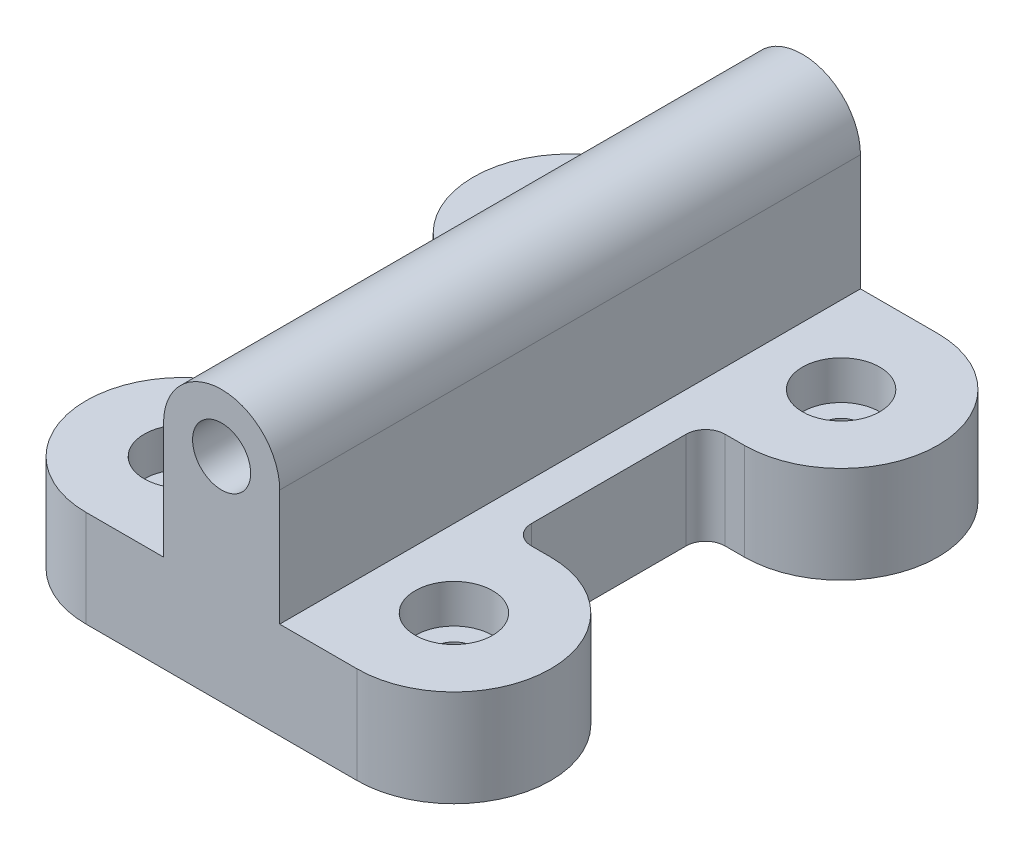
from build123d import *

# Parameters (mm, degrees)
SKETCH_1_R          = 1
EXTRUDE_1_DEPTH     = 5
SKETCH_7_R          = 1.5
EXTRUDE_3_DEPTH     = 30
SKETCH_8_R          = 2
CUT_EXTRUDE_1_DEPTH = 2


with BuildPart() as part:
    # 草图1 → 凸台-拉伸1 (new body)
    with BuildSketch(Plane(origin=(0, 0, 0), x_dir=(1, 0, 0), z_dir=(0, 1, 0))):
        with BuildLine():
            Line((-21.819389518, 18.45581381), (-20.819389518, 18.45581381))
            ThreePointArc((-20.819389518, 18.45581381), (-20.112282737, 18.748707029), (-19.819389518, 19.45581381))
            Line((-19.819389518, 19.45581381), (-19.819389518, 27.45581381))
            ThreePointArc((-19.819389518, 27.45581381), (-20.112282737, 28.162920591), (-20.819389518, 28.45581381))
            Line((-20.819389518, 28.45581381), (-21.819389518, 28.45581381))
            ThreePointArc((-21.819389518, 28.45581381), (-26.819389518, 33.45581381), (-21.819389518, 38.45581381))
            Line((-21.819389518, 38.45581381), (-7.819389518, 38.45581381))
            ThreePointArc((-7.819389518, 38.45581381), (-2.819389518, 33.45581381), (-7.819389518, 28.45581381))
            Line((-7.819389518, 28.45581381), (-8.819389518, 28.45581381))
            ThreePointArc((-8.819389518, 28.45581381), (-9.526496299, 28.162920591), (-9.819389518, 27.45581381))
            Line((-9.819389518, 27.45581381), (-9.819389518, 19.45581381))
            ThreePointArc((-9.819389518, 19.45581381), (-9.526496299, 18.748707029), (-8.819389518, 18.45581381))
            Line((-8.819389518, 18.45581381), (-7.819389518, 18.45581381))
            ThreePointArc((-7.819389518, 18.45581381), (-2.819389518, 13.45581381), (-7.819389518, 8.45581381))
            Line((-7.819389518, 8.45581381), (-21.819389518, 8.45581381))
            ThreePointArc((-21.819389518, 8.45581381), (-26.819389518, 13.45581381), (-21.819389518, 18.45581381))
        make_face()
        with Locations(Location((-21.819389518, 13.45581381, 0), (0, 0, 270))):
            Circle(SKETCH_1_R, mode=Mode.SUBTRACT)
        with Locations(Location((-7.819389518, 13.45581381, 0), (0, 0, 270))):
            Circle(SKETCH_1_R, mode=Mode.SUBTRACT)
        with Locations(Location((-21.819389518, 33.45581381, 0), (0, 0, 270))):
            Circle(SKETCH_1_R, mode=Mode.SUBTRACT)
        with Locations(Location((-7.819389518, 33.45581381, 0), (0, 0, 270))):
            Circle(SKETCH_1_R, mode=Mode.SUBTRACT)
    extrude(amount=EXTRUDE_1_DEPTH)

    # 草图7 → 凸台-拉伸3 (add)
    with BuildSketch(Plane.XY.offset(-8.45581381)):
        with BuildLine():
            Line((-17.819389518, 11), (-17.819389518, 5))
            Line((-17.819389518, 5), (-11.819389518, 5))
            Line((-11.819389518, 5), (-11.819389518, 11))
            ThreePointArc((-11.819389518, 11), (-14.819389518, 14), (-17.819389518, 11))
        make_face()
        with Locations((-14.819389518, 11)):
            Circle(SKETCH_7_R, mode=Mode.SUBTRACT)
    extrude(amount=-EXTRUDE_3_DEPTH)

    # 草图8 → 切除-拉伸1 (cut)
    with BuildSketch(Plane(origin=(0, 5, 0), x_dir=(1, 0, 0), z_dir=(0, 1, 0))):
        with Locations(Location((-21.819389518, 33.45581381, 0), (0, 0, 270))):
            Circle(SKETCH_8_R)
        with Locations(Location((-7.819389518, 33.45581381, 0), (0, 0, 270))):
            Circle(SKETCH_8_R)
        with Locations(Location((-21.819389518, 13.45581381, 0), (0, 0, 270))):
            Circle(SKETCH_8_R)
        with Locations(Location((-7.819389518, 13.45581381, 0), (0, 0, 270))):
            Circle(SKETCH_8_R)
    extrude(amount=-CUT_EXTRUDE_1_DEPTH, mode=Mode.SUBTRACT)


solid = part.part
